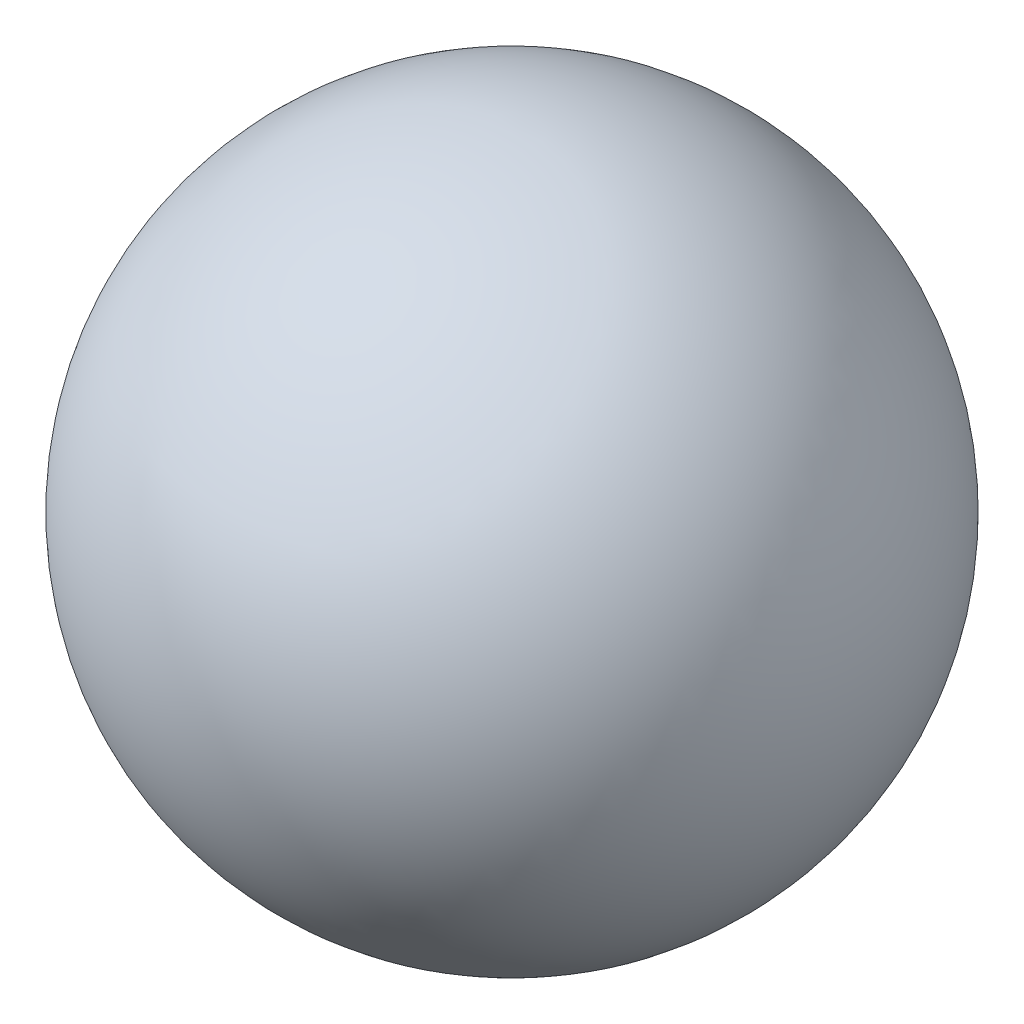
from build123d import *


with BuildPart() as part:
    # 草图1 → Revolve 232 (revolve)
    with BuildSketch(Plane.XY):
        with BuildLine():
            Line((0, -35), (0, 35))
            ThreePointArc((0, 35), (35, 0), (0, -35))
        make_face()
    revolve(axis=Axis((0, -35, 0), (0, 1, 0)))


solid = part.part
